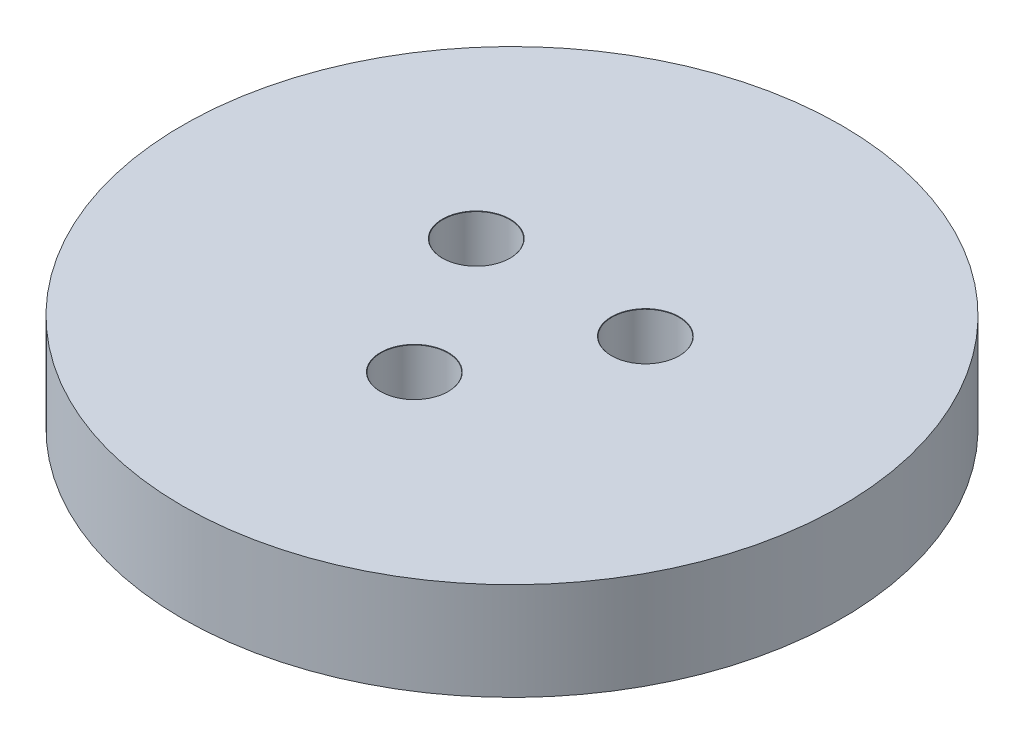
from build123d import *

# Parameters (mm, degrees)
SKETCH1_R                      = 27
BOSS_EXTRUDE1_DEPTH            = 8
M5_CLEARANCE_HOLE1_D           = 5.5
M5_CLEARANCE_HOLE1_CSINK_D     = 5.55
M5_CLEARANCE_HOLE1_CSINK_ANGLE = 90


with BuildPart() as part:
    # Sketch1 → Boss-Extrude1 (new body)
    with BuildSketch(Plane(origin=(0, 0, 0), x_dir=(1, 0, 0), z_dir=(0, 1, 0))):
        with Locations(Location((0, 0, 0), (0, 0, 270))):
            Circle(SKETCH1_R)
    extrude(amount=BOSS_EXTRUDE1_DEPTH)

    # M5 Clearance Hole1 (through all)
    with Locations(Plane(origin=(0, 8, 0), x_dir=(1, 0, 0), z_dir=(0, 1, 0))):
        with Locations((-6.92820323, 4), (6.92820323, 4), (0, -8)):
            CounterSinkHole(M5_CLEARANCE_HOLE1_D / 2, M5_CLEARANCE_HOLE1_CSINK_D / 2, counter_sink_angle=M5_CLEARANCE_HOLE1_CSINK_ANGLE)


solid = part.part
